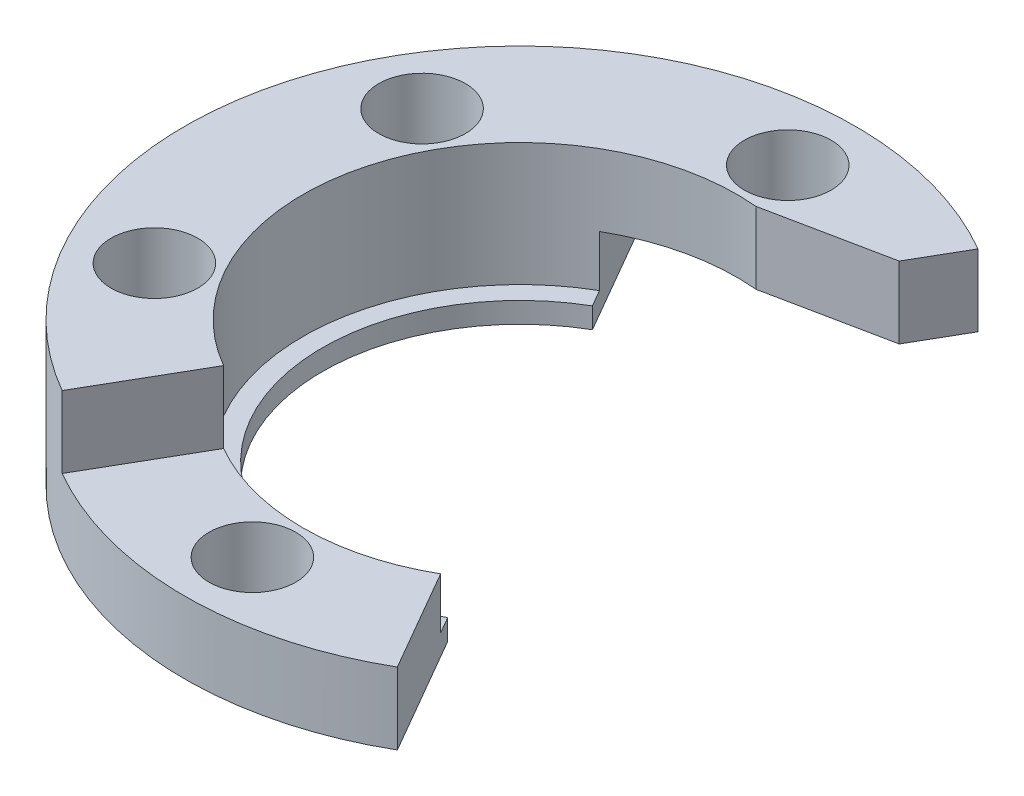
from build123d import *

# Parameters (mm, degrees)
SKETCH1_R         = 16.891
EXTRUDE1_DEPTH    = 7.239
SKETCH2_R         = 10.9347
EXTRUDE2_DEPTH    = 25.960266084
SKETCH3_R         = 10.9347
SKETCH3_R_2       = 9.9568
EXTRUDE3_DEPTH    = 1.0414
SKETCH4_R         = 2.1844
EXTRUDE4_DEPTH    = 25.960266084
CIRPATTERN1_COUNT = 6
EXTRUDE6_DEPTH    = 25.960266084
EXTRUDE7_DEPTH    = 3.6195
EXTRUDE8_DEPTH    = 3.6195
EXTRUDE12_DEPTH   = 25.160143672


with BuildPart() as part:
    # Sketch1 → Extrude1 (new body)
    with BuildSketch(Plane(origin=(0, 0, 0), x_dir=(1, 0, 0), z_dir=(0, 1, 0))):
        with Locations(Location((0, 0, 0), (0, 0, 270))):
            Circle(SKETCH1_R)
    extrude(amount=EXTRUDE1_DEPTH)

    # Sketch2 → Extrude2 (cut, through all)
    with BuildSketch(Plane.XZ):
        with Locations(Location((0, 0, 0), (0, 0, 270))):
            Circle(SKETCH2_R)
    extrude(amount=-EXTRUDE2_DEPTH, mode=Mode.SUBTRACT)

    # Sketch3 → Extrude3 (add)
    with BuildSketch(Plane.XZ):
        with Locations(Location((0, 0, 0), (0, 0, 270))):
            Circle(SKETCH3_R)
        with Locations(Location((0, 0, 0), (0, 0, 270))):
            Circle(SKETCH3_R_2, mode=Mode.SUBTRACT)
    extrude(amount=-EXTRUDE3_DEPTH)

    # Sketch4 → Extrude4 (cut, through all)
    with BuildSketch(Plane(origin=(0, 7.239, 0), x_dir=(1, 0, 0), z_dir=(0, 1, 0))):
        with Locations(Location((0, 13.4874, 0), (0, 0, 270))):
            Circle(SKETCH4_R)
    extrude4 = extrude(amount=-EXTRUDE4_DEPTH, mode=Mode.SUBTRACT)

    # CirPattern1: Extrude4 ×6 about axis
    cirpattern1_axis = Axis((0, 0, 0), (0, 1, 0))
    for i in range(1, CIRPATTERN1_COUNT):
        add(extrude4.rotate(cirpattern1_axis, i * 360 / CIRPATTERN1_COUNT), mode=Mode.SUBTRACT)

    # Sketch7 → Extrude6 (cut, through all)
    with BuildSketch(Plane(origin=(0, 7.239, 0), x_dir=(1, 0, 0), z_dir=(0, 1, 0))):
        Polygon((0, 0), (16.891, 29.256070191), (16.891, -29.256070191), align=None)
    extrude(amount=-EXTRUDE6_DEPTH, mode=Mode.SUBTRACT)

    # Sketch8 → Extrude7 (cut)
    with BuildSketch(Plane(origin=(0, 7.239, 0), x_dir=(1, 0, 0), z_dir=(0, 1, 0))):
        Polygon((0, 0), (9.752023397, -16.891), (-9.752023397, -16.891), align=None)
    extrude(amount=-EXTRUDE7_DEPTH, mode=Mode.SUBTRACT)

    # Sketch9 → Extrude8 (cut)
    with BuildSketch(Plane.XZ):
        Polygon((0, 0), (9.752023397, -16.891), (-9.752023397, -16.891), align=None)
    extrude(amount=-EXTRUDE8_DEPTH, mode=Mode.SUBTRACT)

    # Sketch13 → Extrude12 (cut, through all)
    with BuildSketch(Plane(origin=(0, 3.6195, 0), x_dir=(1, 0, 0), z_dir=(0, 1, 0))):
        Polygon((0.998562219, 10.889009945), (6.992650397, 12.111625767), (4.9784, -8.62284174), align=None)
    extrude(amount=EXTRUDE12_DEPTH, mode=Mode.SUBTRACT)


solid = part.part
